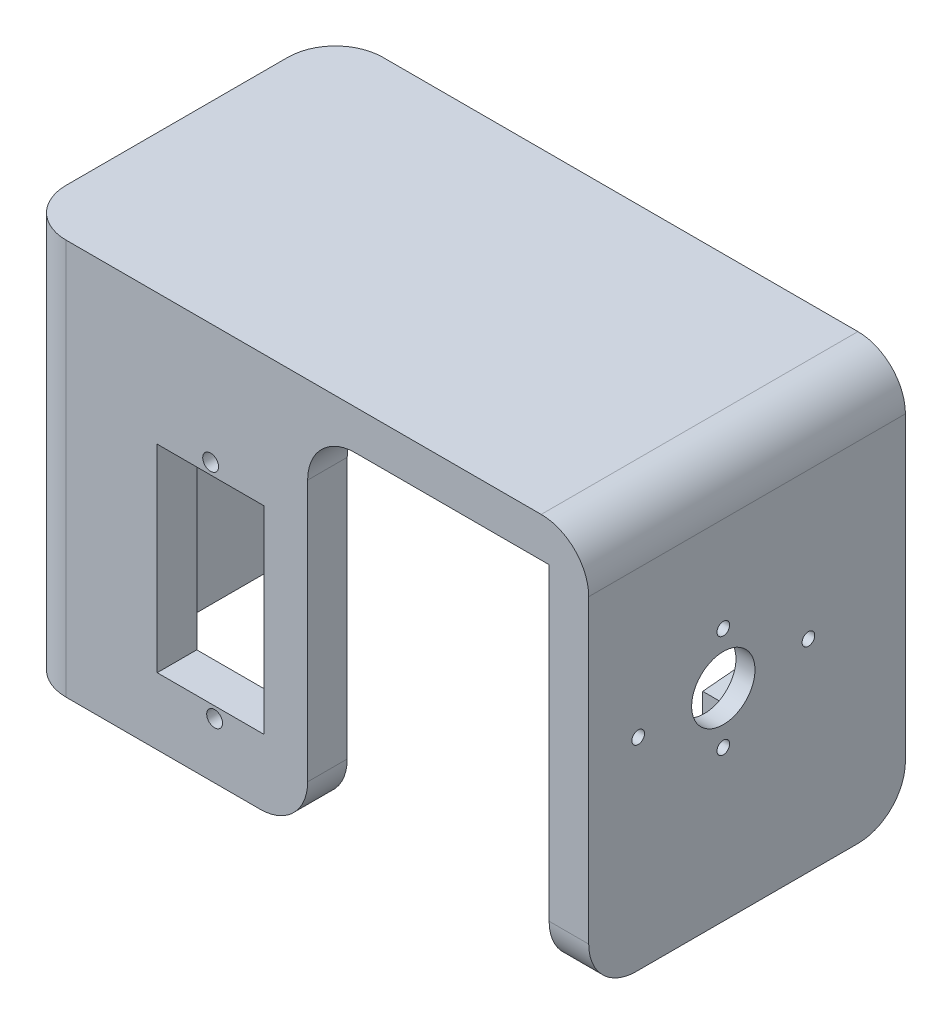
from build123d import *

# Parameters (mm, degrees)
EXTRUDE_1_DEPTH     = 40
FILLET_2_R          = 6
FILLET_3_R          = 6
FILLET_4_R          = 6
FILLET_5_R          = 6
FILLET_6_R          = 6
CUT_EXTRUDE_1_DEPTH = 2.6
EXTRUDE_START       = 45
EXTRUDE_2_DEPTH     = 45
SKETCH_4_R          = 1
SKETCH_4_W          = 13.5
SKETCH_4_H          = 25
CUT_EXTRUDE_2_DEPTH = 60
FILLET_7_R          = 6
FILLET_8_R          = 6
SKETCH_5_R          = 0.8
SKETCH_5_R_2        = 4
CUT_EXTRUDE_3_DEPTH = 10
EXTRUDE_START_2     = -2.5
EXTRUDE_4_DEPTH     = 2.5
FILLET_9_R          = 5


with BuildPart() as part:
    # 草图1 → 凸台-拉伸1 (new body)
    with BuildSketch(Plane.XY):
        Polygon((12.980970113, 56.471676883), (12.980970113, 11.471676883), (17.980970113, 11.471676883), (17.980970113, 61.471676883), (-54.019029887, 61.471676883), (-54.019029887, 56.471676883), (-49.554341186, 56.471676883), align=None)
    extrude(amount=EXTRUDE_1_DEPTH)

    # 圆角2
    fillet_2_edges = [part.edges().sort_by_distance(p)[0] for p in [
        (17.980970113, 61.471676883, 20),
    ]]
    fillet(fillet_2_edges, radius=FILLET_2_R)

    # 圆角3
    fillet_3_edges = [part.edges().sort_by_distance(p)[0] for p in [
        (15.480970113, 11.471676883, 0),
    ]]
    fillet(fillet_3_edges, radius=FILLET_3_R)

    # 圆角4
    fillet_4_edges = [part.edges().sort_by_distance(p)[0] for p in [
        (15.480970113, 11.471676883, 40),
    ]]
    fillet(fillet_4_edges, radius=FILLET_4_R)

    # 圆角5
    fillet_5_edges = [part.edges().sort_by_distance(p)[0] for p in [
        (-54.019029887, 58.971676883, 0),
    ]]
    fillet(fillet_5_edges, radius=FILLET_5_R)

    # 圆角6
    fillet_6_edges = [part.edges().sort_by_distance(p)[0] for p in [
        (-54.019029887, 58.971676883, 40),
    ]]
    fillet(fillet_6_edges, radius=FILLET_6_R)

    # 草图2 → 切除-拉伸1 (cut)
    with BuildSketch(Plane.ZY.offset(-12.980970113)):
        with BuildLine():
            Line((25.4, 43.428225459), (25.4, 40.117895335))
            Line((25.4, 40.117895335), (37.115774764, 39.455783428))
            ThreePointArc((37.115774764, 39.455783428), (39.95, 36.978225459), (37.115774764, 34.500667489))
            Line((37.115774764, 34.500667489), (25.4, 33.838555582))
            Line((25.4, 33.838555582), (25.4, 30.528225459))
            ThreePointArc((25.4, 30.528225459), (23, 28.128225459), (20.6, 30.528225459))
            Line((20.6, 30.528225459), (20.6, 32.921208444))
            Line((20.6, 32.921208444), (5.903894821, 34.243983881))
            ThreePointArc((5.903894821, 34.243983881), (3.404704977, 36.978225459), (5.903894821, 39.712467036))
            Line((5.903894821, 39.712467036), (20.6, 41.035242473))
            Line((20.6, 41.035242473), (20.6, 43.428225459))
            ThreePointArc((20.6, 43.428225459), (23, 45.828225459), (25.4, 43.428225459))
        make_face()
    extrude(amount=-CUT_EXTRUDE_1_DEPTH, mode=Mode.SUBTRACT)

    # 草图3 → 凸台-拉伸2 (add)
    with BuildSketch(Plane.XZ.offset(-56.471676883).offset(EXTRUDE_START)):
        with BuildLine():
            Line((-54.019029887, 34), (-54.019029887, 6))
            Line((-54.019029887, 6), (-49.019029887, 6))
            Line((-49.019029887, 6), (-49.019029887, 29))
            ThreePointArc((-49.019029887, 29), (-47.261670574, 33.242640687), (-43.019029887, 35))
            Line((-43.019029887, 35), (-17.519029887, 35))
            Line((-17.519029887, 35), (-17.519029887, 40))
            Line((-17.519029887, 40), (-48.019029887, 40))
            ThreePointArc((-48.019029887, 40), (-52.261670574, 38.242640687), (-54.019029887, 34))
        make_face()
    extrude(amount=-EXTRUDE_2_DEPTH)

    # 草图4 → 切除-拉伸2 (cut)
    with BuildSketch(Plane.XY.offset(40)):
        with Locations((-29.269029887, 18.508506795)):
            Circle(SKETCH_4_R)
        with Locations((-29.769029887, 46.304010029)):
            Circle(SKETCH_4_R)
        with Locations((-29.769029887, 32.408506795)):
            Rectangle(SKETCH_4_W, SKETCH_4_H)
    extrude(amount=-CUT_EXTRUDE_2_DEPTH, mode=Mode.SUBTRACT)

    # 圆角7
    fillet_7_edges = [part.edges().sort_by_distance(p)[0] for p in [
        (-17.519029887, 11.471676883, 37.5),
    ]]
    fillet(fillet_7_edges, radius=FILLET_7_R)

    # 圆角8
    fillet_8_edges = [part.edges().sort_by_distance(p)[0] for p in [
        (-17.519029887, 56.471676883, 37.5),
    ]]
    fillet(fillet_8_edges, radius=FILLET_8_R)

    # 草图5 → 切除-拉伸3 (cut)
    with BuildSketch(Plane.ZY.offset(-15.580970113)):
        with Locations(Location((12.25, 36.978225459, 0), (0, 0, 270))):
            Circle(SKETCH_5_R)
        with Locations(Location((23, 36.978225459, 0), (0, 0, 270))):
            Circle(SKETCH_5_R_2)
        with Locations(Location((33.75, 36.978225459, 0), (0, 0, 270))):
            Circle(SKETCH_5_R)
        with Locations(Location((23, 30.478225459, 0), (0, 0, 270))):
            Circle(SKETCH_5_R)
        with Locations(Location((23, 43.478225459, 0), (0, 0, 270))):
            Circle(SKETCH_5_R)
    extrude(amount=-CUT_EXTRUDE_3_DEPTH, mode=Mode.SUBTRACT)

    # 草图7 → 凸台-拉伸4 (add)
    with BuildSketch(Plane(origin=(0, 0, 0), x_dir=(-1, 0, 0), z_dir=(0, 0, -1)).offset(EXTRUDE_START_2)):
        with BuildLine():
            Line((-17.980970113, 55.471676883), (-17.980970113, 31.471676883))
            Line((-17.980970113, 31.471676883), (12.019029887, 31.471676883))
            Line((12.019029887, 31.471676883), (12.019029887, 61.471676883))
            Line((12.019029887, 61.471676883), (-11.980970113, 61.471676883))
            ThreePointArc((-11.980970113, 61.471676883), (-16.2236108, 59.71431757), (-17.980970113, 55.471676883))
        make_face()
    extrude(amount=EXTRUDE_4_DEPTH)

    # 圆角9
    fillet_9_edges = [part.edges().sort_by_distance(p)[0] for p in [
        (-12.019029887, 31.471676883, 1.25),
    ]]
    fillet(fillet_9_edges, radius=FILLET_9_R)


solid = part.part
